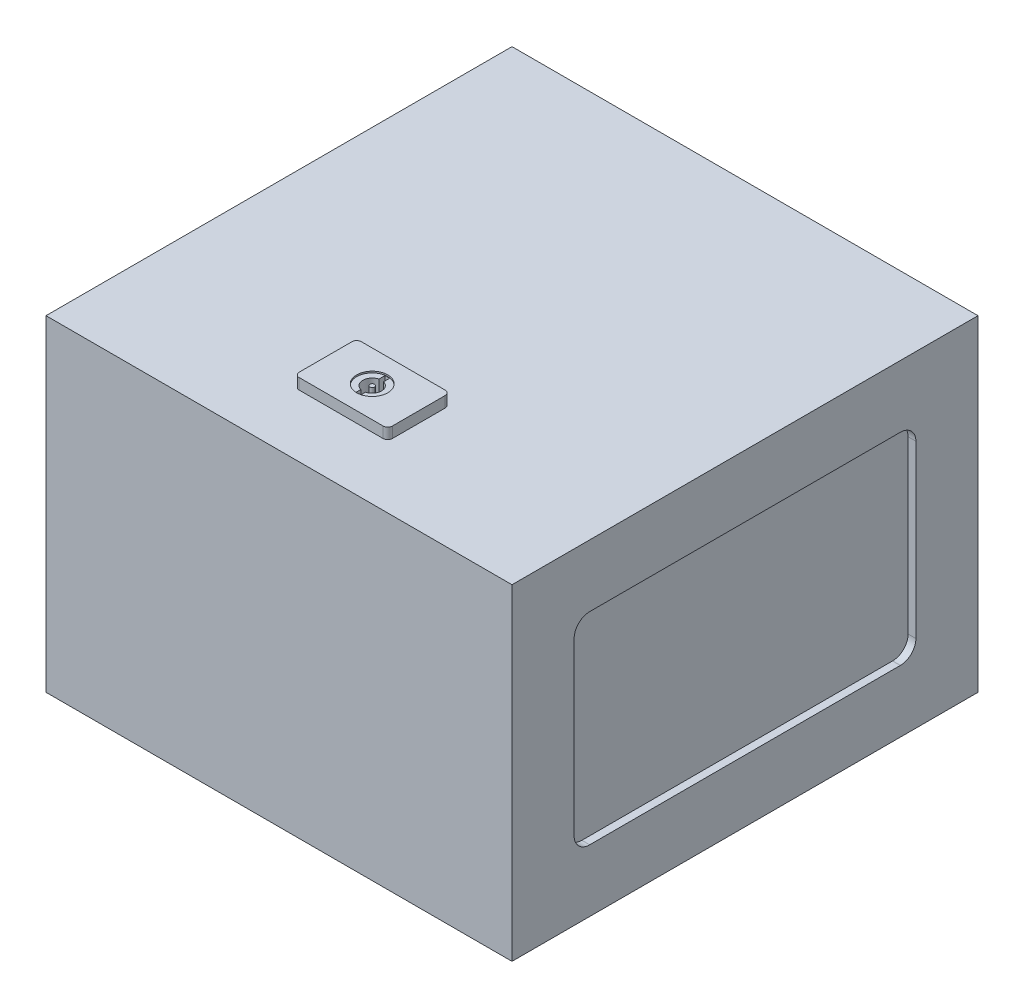
from build123d import *

# Parameters (mm, degrees)
SKETCH1_W           = 300
SKETCH1_H           = 300
BOSS_EXTRUDE1_DEPTH = 210
CUT_EXTRUDE1_DEPTH  = 5
BOSS_EXTRUDE2_DEPTH = 7
SKETCH4_R           = 10
CUT_EXTRUDE2_DEPTH  = 1
SKETCH5_R           = 1.5
CUT_EXTRUDE3_DEPTH  = 10


with BuildPart() as part:
    # Sketch1 → Boss-Extrude1 (new body)
    with BuildSketch(Plane(origin=(0, 0, 0), x_dir=(1, 0, 0), z_dir=(0, 1, 0))):
        Rectangle(SKETCH1_W, SKETCH1_H)
    extrude(amount=BOSS_EXTRUDE1_DEPTH)

    # Sketch2 → Cut-Extrude1 (cut)
    with BuildSketch(Plane(origin=(150, 0, 0), x_dir=(0, 0, -1), z_dir=(1, 0, 0))):
        with BuildLine():
            Line((-100, 170), (100, 170))
            ThreePointArc((100, 170), (107.071067812, 167.071067812), (110, 160))
            Line((110, 160), (110, 50))
            ThreePointArc((110, 50), (107.071067812, 42.928932188), (100, 40))
            Line((100, 40), (-100, 40))
            ThreePointArc((-100, 40), (-107.071067812, 42.928932188), (-110, 50))
            Line((-110, 50), (-110, 160))
            ThreePointArc((-110, 160), (-107.071067812, 167.071067812), (-100, 170))
        make_face()
    extrude(amount=-CUT_EXTRUDE1_DEPTH, mode=Mode.SUBTRACT)

    # Sketch3 → Boss-Extrude2 (add)
    with BuildSketch(Plane(origin=(0, 210, 0), x_dir=(1, 0, 0), z_dir=(0, 1, 0))):
        with BuildLine():
            Line((-27, -110), (27, -110))
            ThreePointArc((27, -110), (29.121320344, -109.121320344), (30, -107))
            Line((30, -107), (30, -73))
            ThreePointArc((30, -73), (29.121320344, -70.878679656), (27, -70))
            Line((27, -70), (-27, -70))
            ThreePointArc((-27, -70), (-29.121320344, -70.878679656), (-30, -73))
            Line((-30, -73), (-30, -107))
            ThreePointArc((-30, -107), (-29.121320344, -109.121320344), (-27, -110))
        make_face()
    extrude(amount=BOSS_EXTRUDE2_DEPTH)

    # Sketch4 → Cut-Extrude2 (cut)
    with BuildSketch(Plane(origin=(0, 217, 0), x_dir=(1, 0, 0), z_dir=(0, 1, 0))):
        with Locations(Location((0, -90, 0), (0, 0, 270))):
            Circle(SKETCH4_R)
    extrude(amount=-CUT_EXTRUDE2_DEPTH, mode=Mode.SUBTRACT)

    # Sketch5 → Cut-Extrude3 (cut)
    with BuildSketch(Plane(origin=(0, 216, 0), x_dir=(1, 0, 0), z_dir=(0, 1, 0))):
        with BuildLine():
            Line((-1.5, -84.190524981), (-1.5, -80.25))
            Line((-1.5, -80.25), (1.5, -80.25))
            Line((1.5, -80.25), (1.5, -84.190524981))
            ThreePointArc((1.5, -84.190524981), (6, -90), (1.5, -95.809475019))
            Line((1.5, -95.809475019), (1.5, -99.75))
            Line((1.5, -99.75), (-1.5, -99.75))
            Line((-1.5, -99.75), (-1.5, -95.809475019))
            ThreePointArc((-1.5, -95.809475019), (-6, -90), (-1.5, -84.190524981))
        make_face()
        with Locations(Location((0, -90, 0), (0, 0, 270))):
            Circle(SKETCH5_R, mode=Mode.SUBTRACT)
    extrude(amount=-CUT_EXTRUDE3_DEPTH, mode=Mode.SUBTRACT)


solid = part.part
